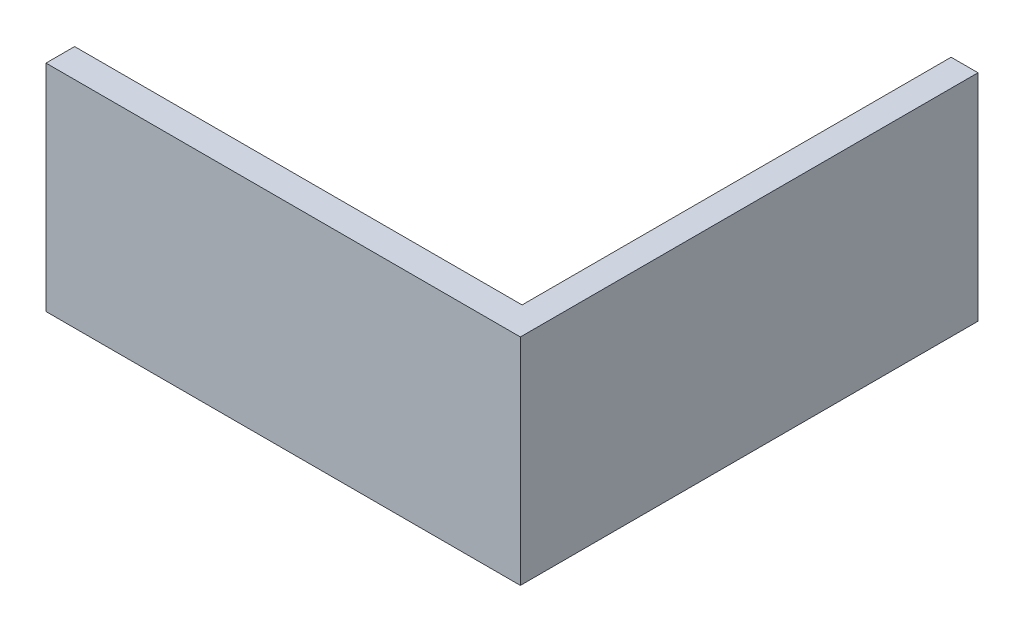
from build123d import *

# Parameters (mm, degrees)
SKETCH1_W           = 165.858872534
SKETCH1_H           = 75.243046816
BOSS_EXTRUDE1_DEPTH = 10
SKETCH2_W           = 9.398863203
SKETCH2_H           = 75.243046816
BOSS_EXTRUDE2_DEPTH = 150
SKETCH4_R           = 5
BOSS_EXTRUDE3_DEPTH = 30
SKETCH5_R           = 5
BOSS_EXTRUDE4_DEPTH = 30


with BuildPart() as part:
    # Sketch1 → Boss-Extrude1 (new body)
    with BuildSketch(Plane.XY):
        Rectangle(SKETCH1_W, SKETCH1_H)
    extrude(amount=BOSS_EXTRUDE1_DEPTH)

    # Sketch2 → Boss-Extrude2 (add)
    with BuildSketch(Plane.XY):
        with Locations((78.230004666, 0)):
            Rectangle(SKETCH2_W, SKETCH2_H)
    extrude(amount=-BOSS_EXTRUDE2_DEPTH)

    # Sketch5 → Boss-Extrude4 (add)
    with BuildSketch(Plane.ZY.offset(-73.530573064)):
        with Locations((-90, 0)):
            Circle(SKETCH5_R)
    extrude(amount=BOSS_EXTRUDE4_DEPTH)


with BuildPart() as body_2:
    # Sketch4 → Boss-Extrude3 (new body)
    with BuildSketch(Plane.XY):
        with Locations((-16.469426936, 0)):
            Circle(SKETCH4_R)
    extrude(amount=-BOSS_EXTRUDE3_DEPTH)


solid = Compound([part.part, body_2.part])
